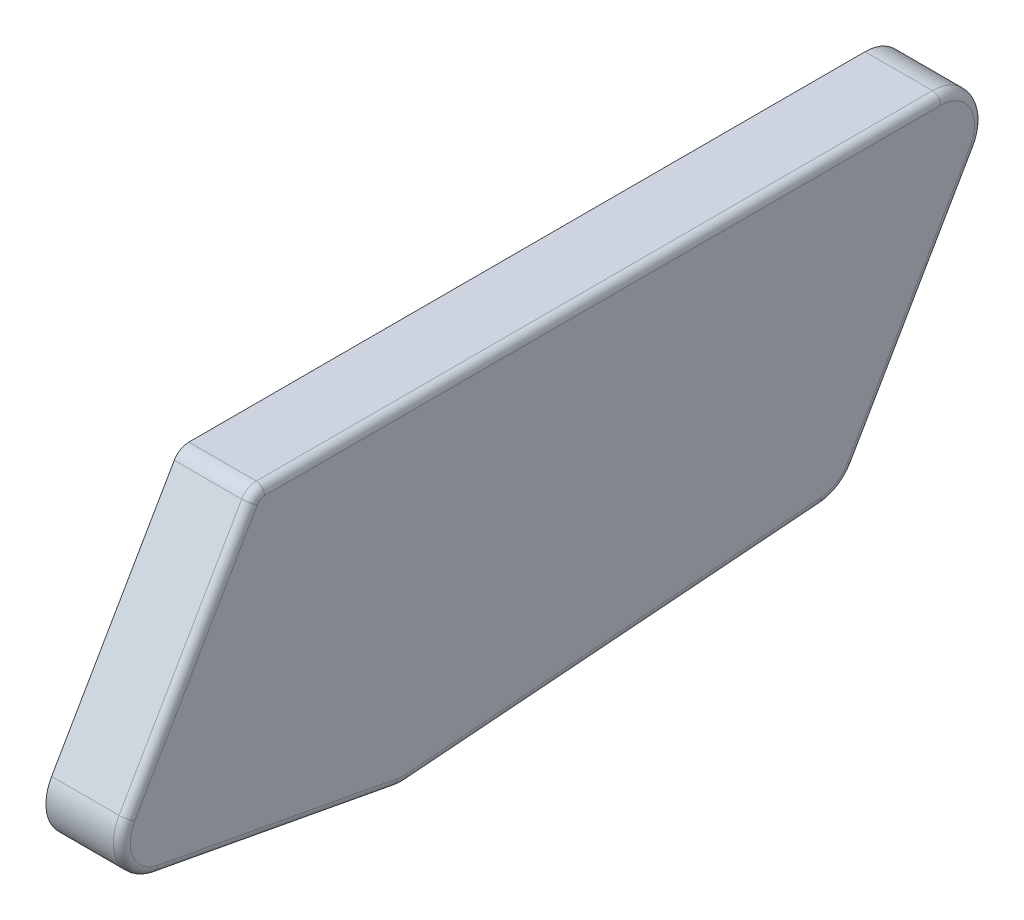
from build123d import *

# Parameters (mm, degrees)
BOSS_EXTRUDE1_DEPTH = 4.5
FILLET2_R           = 1
SHELL1_T            = -0.5


with BuildPart() as part:
    # Sketch1 → Boss-Extrude1 (new, symmetric)
    with BuildSketch(Plane(origin=(0, 0, 0), x_dir=(0, 0, -1), z_dir=(1, 0, 0))):
        with BuildLine():
            Line((-40.125843709, 0), (40.125843709, 0))
            ThreePointArc((40.125843709, 0), (44.455970728, -2.5), (44.455970728, -7.5))
            Line((44.455970728, -7.5), (29.896385384, -32.717941552))
            ThreePointArc((29.896385384, -32.717941552), (28.231372637, -34.448445768), (25.95158068, -35.203072113))
            Line((25.95158068, -35.203072113), (-23.293348854, -39.009425834))
            ThreePointArc((-23.293348854, -39.009425834), (-23.94733545, -39.017072006), (-24.596725125, -38.939290383))
            Line((-24.596725125, -38.939290383), (-53.005406797, -33.632936662))
            ThreePointArc((-53.005406797, -33.632936662), (-56.629531724, -30.808063795), (-56.41747986, -26.217941552))
            Line((-56.41747986, -26.217941552), (-41.857894516, -1))
            ThreePointArc((-41.857894516, -1), (-41.125843709, -0.267949192), (-40.125843709, 0))
        make_face()
    extrude(amount=BOSS_EXTRUDE1_DEPTH, both=True)

    # Fillet2
    fillet2_edges = [part.edges().sort_by_distance(p)[0] for p in [
        (4.5, -30.808063795, 56.629531724),
        (4.5, -36.286113523, 38.801065961),
        (4.5, -39.017072006, 23.94733545),
        (4.5, -37.106248974, -1.329115913),
        (4.5, -34.448445768, -28.231372637),
        (4.5, -20.108970776, -37.176178056),
        (4.5, -2.5, -44.455970728),
        (4.5, 0, 0),
        (4.5, -0.267949192, 41.125843709),
        (4.5, -13.608970776, 49.137687188),
    ]]
    fillet(fillet2_edges, radius=FILLET2_R)

    # Shell1
    shell1_openings = [part.faces().sort_by_distance(p)[0] for p in [
        (-4.5, -18.296225023, 6.473740626),
    ]]
    offset(amount=SHELL1_T, openings=shell1_openings, kind=Kind.INTERSECTION)


solid = part.part
